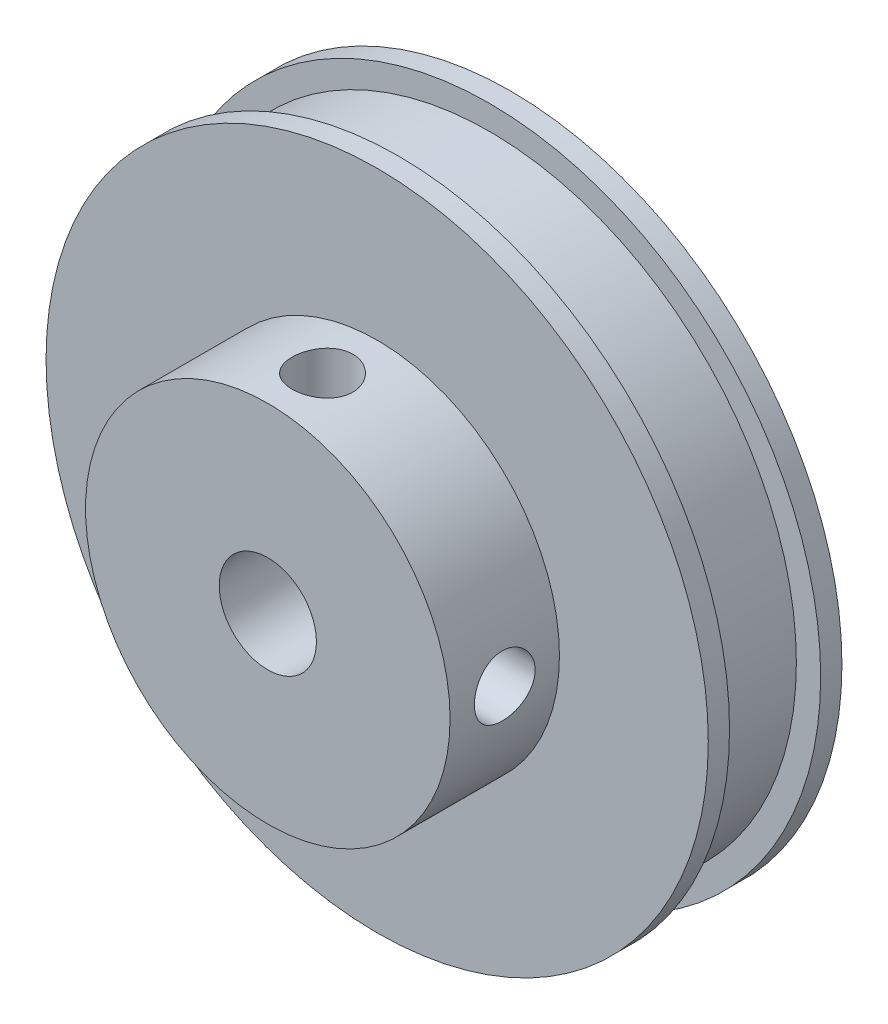
from build123d import *

# Parameters (mm, degrees)
SKETCH1_R               = 27.25
BOSS_EXTRUDE1_DEPTH     = 1.75
SKETCH2_R               = 25.25
BOSS_EXTRUDE2_DEPTH     = 7.5
SKETCH3_R               = 27.25
BOSS_EXTRUDE3_DEPTH     = 1.75
SKETCH4_R               = 15
BOSS_EXTRUDE4_DEPTH     = 9
SKETCH6_R               = 4
CUT_EXTRUDE1_DEPTH      = 20
CUT_EXTRUDE2_REACH      = 45.418
CUT_EXTRUDE2_END_RADIUS = 15
SKETCH7_R               = 2.5
CUT_EXTRUDE3_REACH      = 45.418
CUT_EXTRUDE3_END_RADIUS = 15
SKETCH8_R               = 2.5


with BuildPart() as part:
    # Sketch1 → Boss-Extrude1 (new body)
    with BuildSketch(Plane.XY):
        Circle(SKETCH1_R)
    extrude(amount=BOSS_EXTRUDE1_DEPTH)

    # Sketch2 → Boss-Extrude2 (add)
    with BuildSketch(Plane.XY.offset(1.75)):
        Circle(SKETCH2_R)
    extrude(amount=BOSS_EXTRUDE2_DEPTH)

    # Sketch3 → Boss-Extrude3 (add)
    with BuildSketch(Plane.XY.offset(9.25)):
        Circle(SKETCH3_R)
    extrude(amount=BOSS_EXTRUDE3_DEPTH)

    # Sketch4 → Boss-Extrude4 (add)
    with BuildSketch(Plane.XY.offset(11)):
        Circle(SKETCH4_R)
    extrude(amount=BOSS_EXTRUDE4_DEPTH)

    # Sketch6 → Cut-Extrude1 (cut)
    with BuildSketch(Plane.XY.offset(20)):
        Circle(SKETCH6_R)
    extrude(amount=-CUT_EXTRUDE1_DEPTH, mode=Mode.SUBTRACT)

    # Cut-Extrude2: up to this cylinder (the profile starts inside it)
    cut_extrude2_end = Plane(origin=(0, 0, 15.5), z_dir=(0, 0, -1)) * Cylinder(CUT_EXTRUDE2_END_RADIUS, 121.836, mode=Mode.PRIVATE)
    # Sketch7 → Cut-Extrude2 (cut, up to the surface)
    with BuildSketch(Plane.ZY, mode=Mode.PRIVATE) as cut_extrude2_sk1:
        with Locations((15.5, 0)):
            Circle(SKETCH7_R)
    cut_extrude2_tool1 = extrude(cut_extrude2_sk1.sketch, amount=-CUT_EXTRUDE2_REACH, mode=Mode.PRIVATE) & cut_extrude2_end
    add(cut_extrude2_tool1.solids().sort_by_distance((0, 0, 15.5))[0], mode=Mode.SUBTRACT)

    # Cut-Extrude3: up to this cylinder (the profile starts inside it)
    cut_extrude3_end = Plane(origin=(0, 0, 15.5), z_dir=(0, 0, -1)) * Cylinder(CUT_EXTRUDE3_END_RADIUS, 121.836, mode=Mode.PRIVATE)
    # Sketch8 → Cut-Extrude3 (cut, up to the surface)
    with BuildSketch(Plane(origin=(0, 0, 0), x_dir=(0, 0, 1), z_dir=(0, -1, 0)), mode=Mode.PRIVATE) as cut_extrude3_sk1:
        with Locations(Location((15.5, 0, 0), (0, 0, 180))):
            Circle(SKETCH8_R)
    cut_extrude3_tool1 = extrude(cut_extrude3_sk1.sketch, amount=-CUT_EXTRUDE3_REACH, mode=Mode.PRIVATE) & cut_extrude3_end
    add(cut_extrude3_tool1.solids().sort_by_distance((0, 0, 15.5))[0], mode=Mode.SUBTRACT)


solid = part.part
